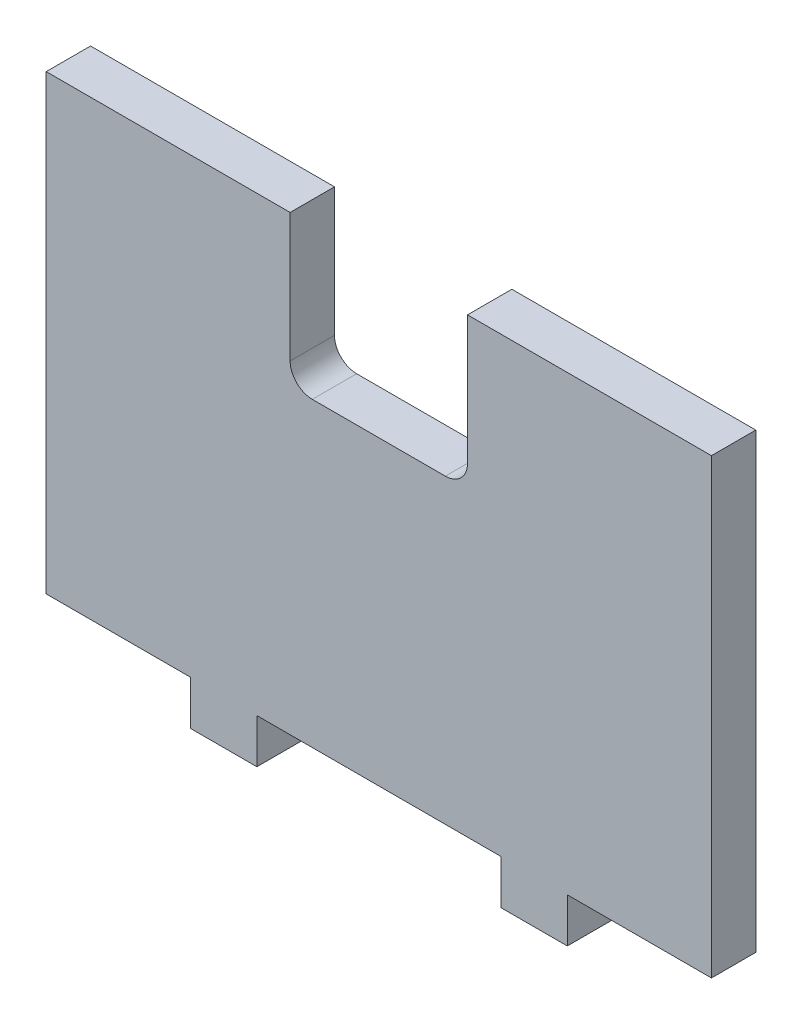
from build123d import *

# Parameters (mm, degrees)
EXTRUDE1_DEPTH     = 12.7
SKETCH2_W          = 50.8
SKETCH2_H          = 43.18
CUT_EXTRUDE1_DEPTH = 172.656838198
FILLET1_R          = 6.35


with BuildPart() as part:
    # Sketch1 → Extrude1 (new body)
    with BuildSketch(Plane.XY):
        Polygon((-95.25, 142.24), (95.25, 142.24), (95.25, 12.7), (53.975, 12.7), (53.975, 0), (34.925, 0), (34.925, 12.7), (-34.925, 12.7), (-34.925, 0), (-53.975, 0), (-53.975, 12.7), (-95.25, 12.7), align=None)
    extrude(amount=-EXTRUDE1_DEPTH)

    # Sketch2 → Cut-Extrude1 (cut, through all)
    with BuildSketch(Plane.XY):
        with Locations((0, 120.65)):
            Rectangle(SKETCH2_W, SKETCH2_H)
    extrude(amount=-CUT_EXTRUDE1_DEPTH, mode=Mode.SUBTRACT)

    # Fillet1
    fillet1_edges = [part.edges().sort_by_distance(p)[0] for p in [
        (-25.4, 99.06, -6.35),
        (25.4, 99.06, -6.35),
    ]]
    fillet(fillet1_edges, radius=FILLET1_R)


solid = part.part
